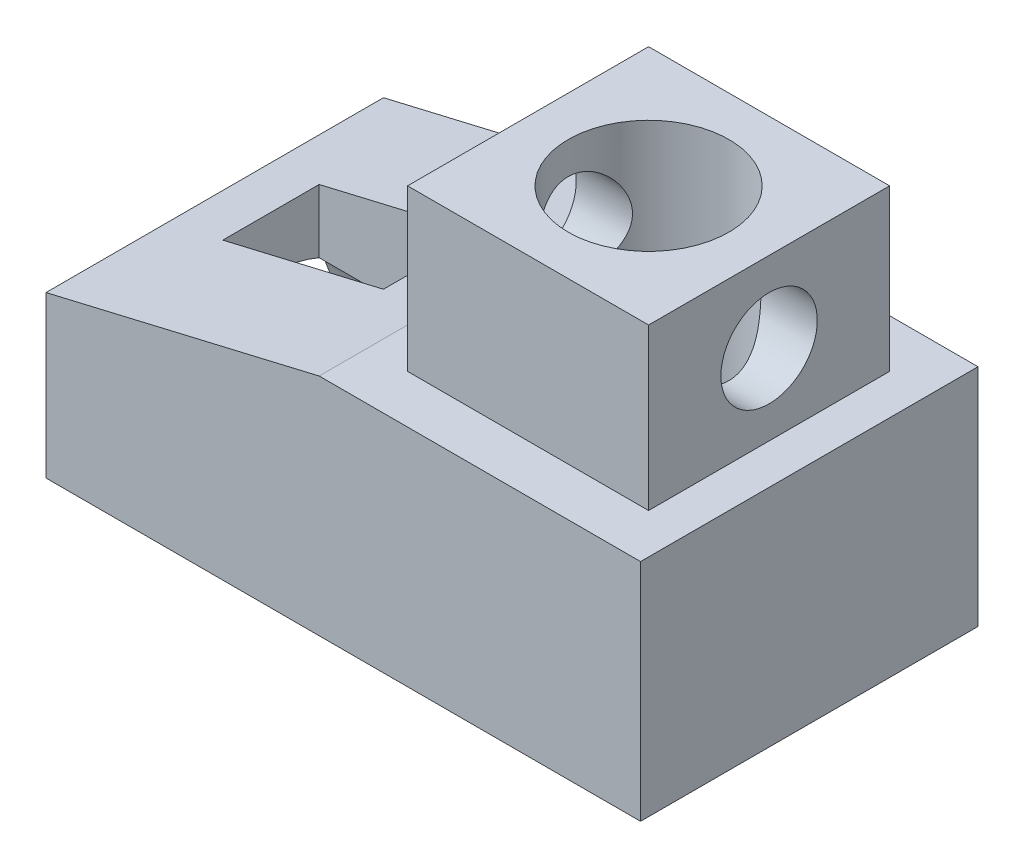
from build123d import *

# Parameters (mm, degrees)
BOSS_EXTRUDE1_DEPTH = 42
SKETCH3_W           = 20
SKETCH3_H           = 12
CUT_EXTRUDE1_DEPTH  = 42
CUT_EXTRUDE2_DEPTH  = 45
SKETCH5_W           = 30
SKETCH5_H           = 20
CUT_EXTRUDE3_DEPTH  = 6
SKETCH6_W           = 30
SKETCH6_H           = 20
CUT_EXTRUDE4_DEPTH  = 6
CUT_EXTRUDE5_DEPTH  = 27
SKETCH8_R           = 6
CUT_EXTRUDE6_DEPTH  = 42
SKETCH9_R           = 7.5
CUT_EXTRUDE7_DEPTH  = 70
CUT_EXTRUDE8_DEPTH  = 27
SKETCH11_R          = 10
CUT_EXTRUDE9_DEPTH  = 58


with BuildPart() as part:
    # Sketch2 → Boss-Extrude1 (new body)
    with BuildSketch(Plane.XY):
        Polygon((0, 28), (39, 28), (39, 48), (69, 48), (69, 28), (74, 28), (74, 0), (0, 0), align=None)
    extrude(amount=BOSS_EXTRUDE1_DEPTH)

    # Sketch3 → Cut-Extrude1 (cut)
    with BuildSketch(Plane(origin=(0, 28, 0), x_dir=(1, 0, 0), z_dir=(0, 1, 0))):
        with Locations((17, -21)):
            Rectangle(SKETCH3_W, SKETCH3_H)
    extrude(amount=-CUT_EXTRUDE1_DEPTH, mode=Mode.SUBTRACT)

    # Sketch4 → Cut-Extrude2 (cut)
    with BuildSketch(Plane.XY.offset(42)):
        Polygon((0, 20), (34, 28), (0, 28), align=None)
    extrude(amount=-CUT_EXTRUDE2_DEPTH, mode=Mode.SUBTRACT)

    # Sketch5 → Cut-Extrude3 (cut)
    with BuildSketch(Plane.XY.offset(42)):
        with Locations((54, 38)):
            Rectangle(SKETCH5_W, SKETCH5_H)
    extrude(amount=-CUT_EXTRUDE3_DEPTH, mode=Mode.SUBTRACT)

    # Sketch6 → Cut-Extrude4 (cut)
    with BuildSketch(Plane(origin=(0, 0, 0), x_dir=(-1, 0, 0), z_dir=(0, 0, -1))):
        with Locations((-54, 38)):
            Rectangle(SKETCH6_W, SKETCH6_H)
    extrude(amount=-CUT_EXTRUDE4_DEPTH, mode=Mode.SUBTRACT)

    # Sketch7 → Cut-Extrude5 (cut)
    with BuildSketch(Plane.ZY):
        with BuildLine():
            ThreePointArc((13.5, 0), (21, -7.5), (28.5, 0))
            Line((28.5, 0), (13.5, 0))
        make_face()
        with BuildLine():
            Line((13.5, 0), (28.5, 0))
            ThreePointArc((28.5, 0), (21, 7.5), (13.5, 0))
        make_face()
    extrude(amount=-CUT_EXTRUDE5_DEPTH, mode=Mode.SUBTRACT)

    # Sketch8 → Cut-Extrude6 (cut)
    with BuildSketch(Plane.ZY.offset(-39)):
        with Locations((21, 38)):
            Circle(SKETCH8_R)
    extrude(amount=-CUT_EXTRUDE6_DEPTH, mode=Mode.SUBTRACT)

    # Sketch9 → Cut-Extrude7 (cut)
    with BuildSketch(Plane(origin=(0, 48, 0), x_dir=(1, 0, 0), z_dir=(0, 1, 0))):
        with Locations(Location((54, -21, 0), (0, 0, 270))):
            Circle(SKETCH9_R)
    extrude(amount=-CUT_EXTRUDE7_DEPTH, mode=Mode.SUBTRACT)

    # Sketch10 → Cut-Extrude8 (cut)
    with BuildSketch(Plane.ZY):
        with BuildLine():
            ThreePointArc((36, 0), (21, 15), (6, 0))
            Line((6, 0), (13.5, 0))
            ThreePointArc((13.5, 0), (21, 7.5), (28.5, 0))
            Line((28.5, 0), (36, 0))
        make_face()
        with BuildLine():
            Line((13.5, 0), (6, 0))
            ThreePointArc((6, 0), (21, -15), (36, 0))
            Line((36, 0), (28.5, 0))
            ThreePointArc((28.5, 0), (21, 7.5), (13.5, 0))
        make_face()
    extrude(amount=-CUT_EXTRUDE8_DEPTH, mode=Mode.SUBTRACT)

    # Sketch11 → Cut-Extrude9 (cut)
    with BuildSketch(Plane(origin=(0, 48, 0), x_dir=(1, 0, 0), z_dir=(0, 1, 0))):
        with Locations(Location((54, -21, 0), (0, 0, 270))):
            Circle(SKETCH11_R)
    extrude(amount=-CUT_EXTRUDE9_DEPTH, mode=Mode.SUBTRACT)


solid = part.part
